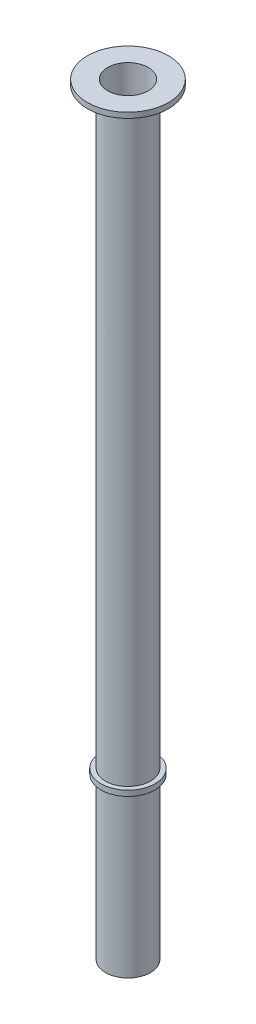
from build123d import *

# Parameters (mm, degrees)
SKETCH1_R           = 12.5
SKETCH1_R_2         = 11.25
BOSS_EXTRUDE1_DEPTH = 210
SKETCH2_R           = 22.5
SKETCH2_R_2         = 11.25
BOSS_EXTRUDE2_DEPTH = 3
BOSS_EXTRUDE3_START = 3
SKETCH3_R           = 15
SKETCH3_R_2         = 11.25
BOSS_EXTRUDE3_DEPTH = 3


with BuildPart() as part:
    # Sketch1 → Boss-Extrude1 (new, symmetric)
    with BuildSketch(Plane(origin=(0, 0, 0), x_dir=(1, 0, 0), z_dir=(0, 1, 0))):
        with Locations(Location((0, 0, 0), (0, 0, 270))):
            Circle(SKETCH1_R)
        with Locations(Location((0, 0, 0), (0, 0, 270))):
            Circle(SKETCH1_R_2, mode=Mode.SUBTRACT)
    extrude(amount=BOSS_EXTRUDE1_DEPTH, both=True)

    # Sketch2 → Boss-Extrude2 (add)
    with BuildSketch(Plane(origin=(0, 210, 0), x_dir=(1, 0, 0), z_dir=(0, 1, 0))):
        with Locations(Location((0, 0, 0), (0, 0, 270))):
            Circle(SKETCH2_R)
        with Locations(Location((0, 0, 0), (0, 0, 270))):
            Circle(SKETCH2_R_2, mode=Mode.SUBTRACT)
    extrude(amount=BOSS_EXTRUDE2_DEPTH)

    # Sketch3 → Boss-Extrude3 (add)
    with BuildSketch(Plane(origin=(0, -118, 0), x_dir=(-1, 0, 0), z_dir=(0, -1, 0)).offset(BOSS_EXTRUDE3_START)):
        with Locations(Location((0, 0, 0), (0, 0, 90))):
            Circle(SKETCH3_R)
        with Locations(Location((0, 0, 0), (0, 0, 270))):
            Circle(SKETCH3_R_2, mode=Mode.SUBTRACT)
    extrude(amount=-BOSS_EXTRUDE3_DEPTH)


solid = part.part
